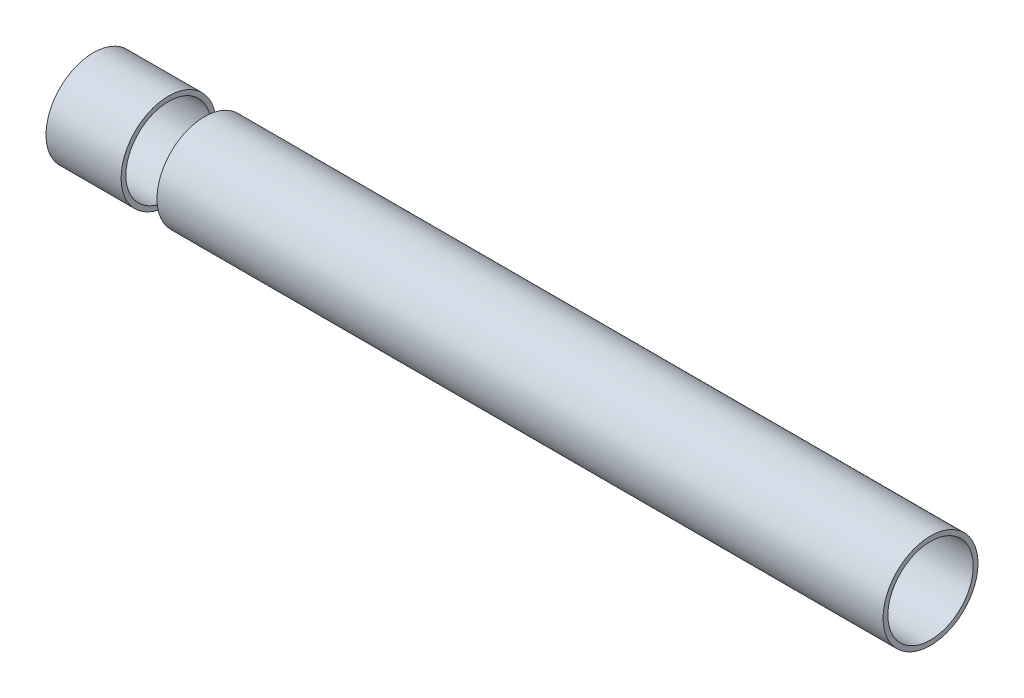
from build123d import *

# Parameters (mm, degrees)
SKETCH1_R               = 15.875
SKETCH1_R_2             = 14.2875
EXTRUDE_THIN1_DEPTH     = 140.019255902
CUT_EXTRUDE1_DEPTH      = 142.807698216
CUT_EXTRUDE1_DEPTH_BACK = 142.807698216
SKETCH2_W               = 11.999999876
SKETCH2_H               = 31.75


with BuildPart() as part:
    # Sketch1 → Extrude-Thin1 (new, symmetric)
    with BuildSketch(Plane(origin=(0, 0, 0), x_dir=(0, 0, -1), z_dir=(1, 0, 0))):
        Circle(SKETCH1_R)
        Circle(SKETCH1_R_2, mode=Mode.SUBTRACT)
    extrude(amount=EXTRUDE_THIN1_DEPTH, both=True)

    # Sketch2 → Cut-Extrude1 (cut, two sides: drawn at the far end of the back side and taken through both)
    with BuildSketch(Plane(origin=(0, 0, 0), x_dir=(1, 0, 0), z_dir=(0, 1, 0)).offset(-CUT_EXTRUDE1_DEPTH_BACK)):
        with Locations((-108.895311038, 0)):
            Rectangle(SKETCH2_W, SKETCH2_H)
    extrude(amount=CUT_EXTRUDE1_DEPTH + CUT_EXTRUDE1_DEPTH_BACK, mode=Mode.SUBTRACT)


with BuildPart() as cut_extrude1_piece_1:
    # of the separate pieces the step leaves, piece 1, a body of its own (cut_extrude1_pieces)
    add(part.part.solids().sort_by_distance((-102.8953111, 0, -15.875))[0])


with BuildPart() as cut_extrude1_piece_2:
    # of the separate pieces the step leaves, piece 2, a body of its own (cut_extrude1_pieces)
    add(part.part.solids().sort_by_distance((-140.019255902, 0, -15.875))[0])


solid = Compound([cut_extrude1_piece_1.part, cut_extrude1_piece_2.part])
